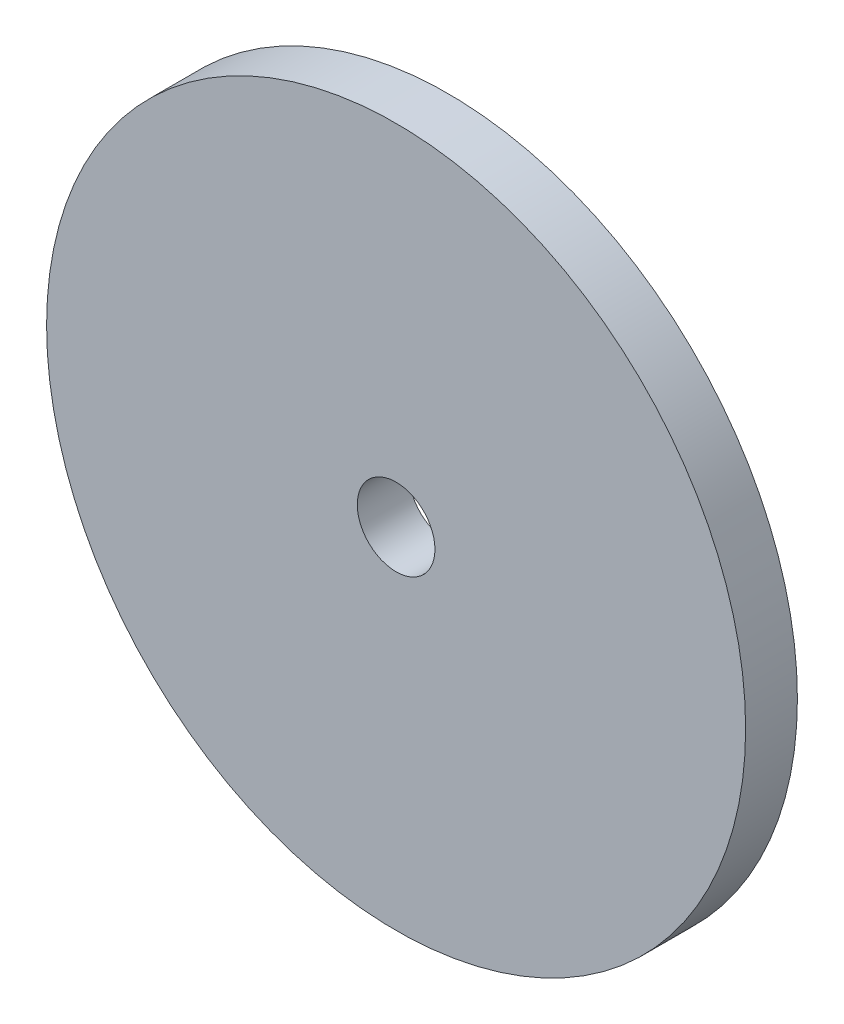
from build123d import *

# Parameters (mm, degrees)
SKETCH1_R           = 13.5
SKETCH1_R_2         = 1.5
BOSS_EXTRUDE1_DEPTH = 2


with BuildPart() as part:
    # Sketch1 → Boss-Extrude1 (new body)
    with BuildSketch(Plane.XY):
        Circle(SKETCH1_R)
        Circle(SKETCH1_R_2, mode=Mode.SUBTRACT)
    extrude(amount=BOSS_EXTRUDE1_DEPTH)


solid = part.part
